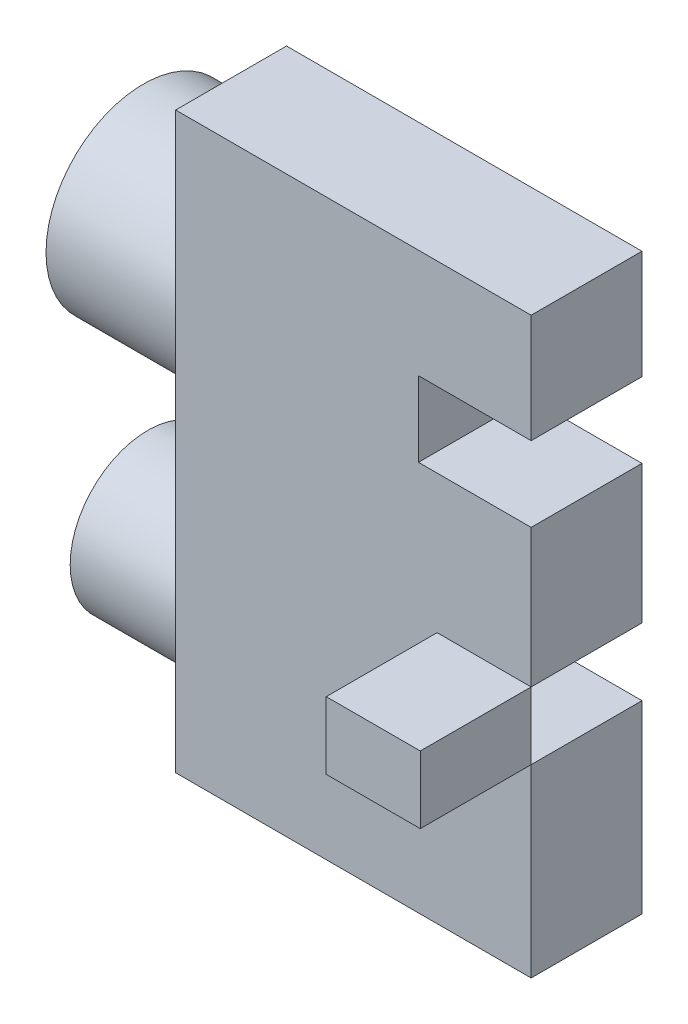
from build123d import *

# Parameters (mm, degrees)
SKETCH_2_W          = 32.066867352
SKETCH_2_H          = 51.780105479
EXTRUDE_1_DEPTH     = 10
SKETCH_3_W          = 12.917655966
SKETCH_3_H          = 8.778717504
SKETCH_4_W          = 12.512273986
SKETCH_4_H          = 7.004295881
SKETCH_5_W          = 8.483669896
SKETCH_5_H          = 6.070389764
SKETCH_5_W_2        = 10.164700908
SKETCH_5_H_2        = 6.770819351
CUT_EXTRUDE_1_DEPTH = 10
SKETCH_5_3_W        = 8.483669896
SKETCH_5_3_H        = 6.070389764
EXTRUDE_2_DEPTH     = 10


with BuildPart() as part:
    # 草图2 → 凸台-拉伸1 (new body)
    with BuildSketch(Plane.XY):
        with Locations((16.033433676, 25.89005274)):
            Rectangle(SKETCH_2_W, SKETCH_2_H)
    extrude(amount=EXTRUDE_1_DEPTH)

    # 草图3 → 旋转1 (revolve)
    with BuildSketch(Plane.XY):
        with Locations((-6.458827983, 37.960789308)):
            Rectangle(SKETCH_3_W, SKETCH_3_H)
    revolve(axis=Axis((-12.917655966, 33.571430556, 0), (1, 0, 0)))

    # 草图4 → 旋转2 (revolve)
    with BuildSketch(Plane.XY):
        with Locations((-6.256136993, 11.998199242)):
            Rectangle(SKETCH_4_W, SKETCH_4_H)
    revolve(axis=Axis((-12.512273986, 8.496051301, 0), (1, 0, 0)))

    # 草图5 → 切除-拉伸1 (cut)
    with BuildSketch(Plane.XY.offset(10)):
        with Locations((27.825032404, 19.702924711)):
            Rectangle(SKETCH_5_W, SKETCH_5_H)
        with Locations((26.984516898, 38.591175938)):
            Rectangle(SKETCH_5_W_2, SKETCH_5_H_2)
    extrude(amount=-CUT_EXTRUDE_1_DEPTH, mode=Mode.SUBTRACT)


with BuildPart() as body_2:
    # 草图5<3> → 凸台-拉伸2 (new body)
    with BuildSketch(Plane.XY.offset(10)):
        with Locations((27.825032404, 19.702924711)):
            Rectangle(SKETCH_5_3_W, SKETCH_5_3_H)
    extrude(amount=EXTRUDE_2_DEPTH)


solid = Compound([part.part, body_2.part])
